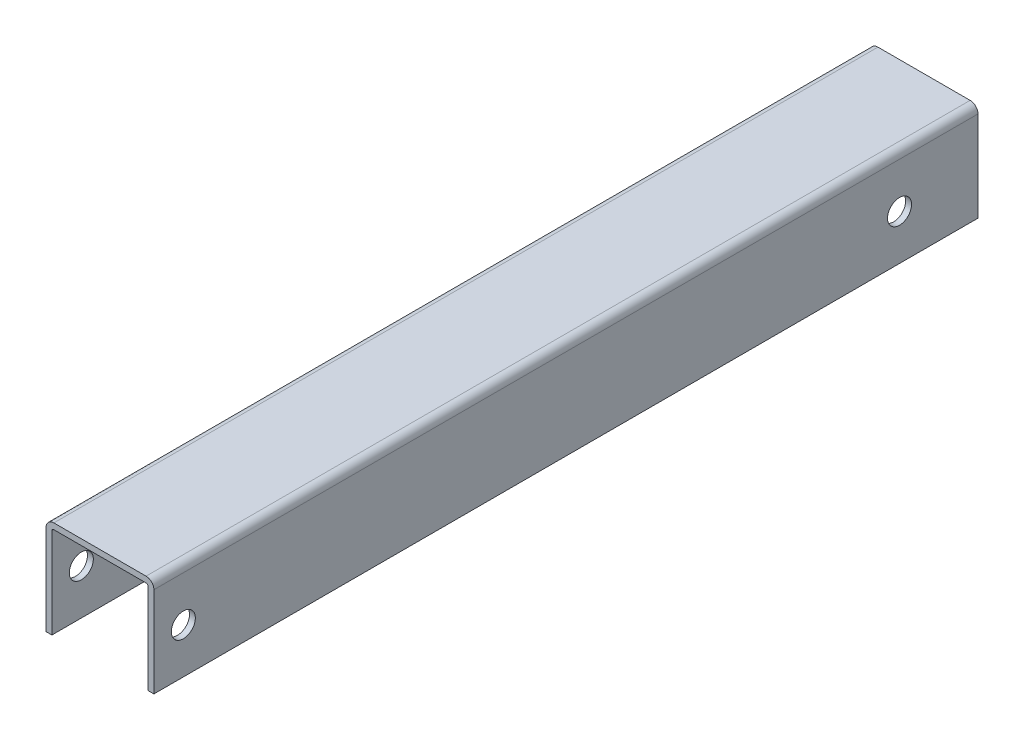
from build123d import *

# Parameters (mm, degrees)
EKSTR_ZYON_NCE6_DEPTH                 = 420
M12_HELISARMAL_I_IN_Z_VANA_MATKAB_2_D = 12.25
M12_HELISARMAL_I_IN_Z_VANA_MATKAB_1_D = 12.25


with BuildPart() as part:
    # Çizim1 → Ekstrüzyon-İnce6 (new body)
    with BuildSketch(Plane.XY):
        with BuildLine():
            Line((-25.44311251, -27.126351083), (-25.44311251, 18.873648917))
            ThreePointArc((-25.44311251, 18.873648917), (-24.271539634, 21.702076041), (-21.44311251, 22.873648917))
            Line((-21.44311251, 22.873648917), (25.55688749, 22.873648917))
            ThreePointArc((25.55688749, 22.873648917), (28.385314615, 21.702076041), (29.55688749, 18.873648917))
            Line((29.55688749, 18.873648917), (29.55688749, -27.126351083))
            Line((29.55688749, -27.126351083), (26.55688749, -27.126351083))
            Line((26.55688749, -27.126351083), (26.55688749, 18.873648917))
            ThreePointArc((26.55688749, 18.873648917), (26.263994271, 19.580755698), (25.55688749, 19.873648917))
            Line((25.55688749, 19.873648917), (-21.44311251, 19.873648917))
            ThreePointArc((-21.44311251, 19.873648917), (-22.150219291, 19.580755698), (-22.44311251, 18.873648917))
            Line((-22.44311251, 18.873648917), (-22.44311251, -27.126351083))
            Line((-22.44311251, -27.126351083), (-25.44311251, -27.126351083))
        make_face()
    extrude(amount=EKSTR_ZYON_NCE6_DEPTH)

    # M12 Helisarmal için Zıvana matkabı2 (through all)
    with Locations(Plane.ZY.offset(25.44311251)):
        with Locations((40, -4.126351083)):
            Hole(M12_HELISARMAL_I_IN_Z_VANA_MATKAB_2_D / 2)

    # M12 Helisarmal için Zıvana matkabı1 (through all)
    with Locations(Plane.ZY.offset(25.44311251)):
        with Locations((405, -4.126351083)):
            Hole(M12_HELISARMAL_I_IN_Z_VANA_MATKAB_1_D / 2)


solid = part.part
